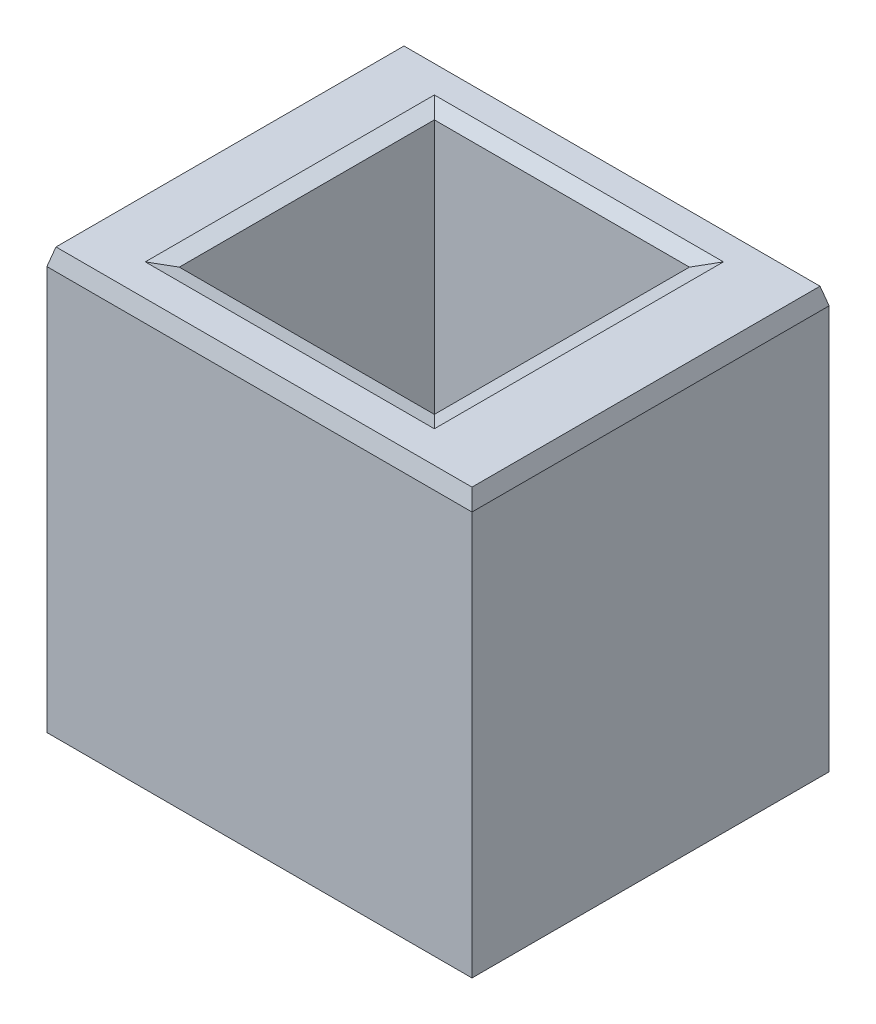
from build123d import *
from OCP.BRepFilletAPI import BRepFilletAPI_MakeChamfer

# Parameters (mm, degrees)
SKETCH1_W           = 127
SKETCH1_H           = 106.690831556
BOSS_EXTRUDE1_DEPTH = 127
SKETCH3_W           = 76.2
SKETCH3_H           = 76.2
CUT_EXTRUDE1_DEPTH  = 165.203782008
CHAMFER1_SIZE       = 5.08
CHAMFER1_SIZE2      = 1.361181898


with BuildPart() as part:
    # Sketch1 → Boss-Extrude1 (new body)
    with BuildSketch(Plane(origin=(0, 0, 0), x_dir=(1, 0, 0), z_dir=(0, 1, 0))):
        with Locations((5.280383795, -24.777185501)):
            Rectangle(SKETCH1_W, SKETCH1_H)
    extrude(amount=BOSS_EXTRUDE1_DEPTH)

    # Sketch3 → Cut-Extrude1 (cut, through all)
    with BuildSketch(Plane(origin=(0, 0, 0), x_dir=(1, 0, 0), z_dir=(0, 1, 0))):
        with Locations((3.524009173, -24.106880488)):
            Rectangle(SKETCH3_W, SKETCH3_H)
    extrude(amount=CUT_EXTRUDE1_DEPTH, mode=Mode.SUBTRACT)

    # Chamfer1: one chamfer whose edges measure the first distance from different faces: ONE call of the kernel's chamfer builder (chamfer() names one face for all edges)
    chamfer1_edges_1 = [part.edges().sort_by_distance(p)[0] for p in [
        (68.780383795, 127, 24.777185501),
    ]]
    chamfer1_side_1 = [part.faces().sort_by_distance(p)[0] for p in [
        (68.780383795, 63.5, 24.777185501),
    ]]
    chamfer1_edges_2 = [part.edges().sort_by_distance(p)[0] for p in [
        (5.280383795, 127, -28.568230277),
    ]]
    chamfer1_side_2 = [part.faces().sort_by_distance(p)[0] for p in [
        (5.280383795, 63.5, -28.568230277),
    ]]
    chamfer1_edges_3 = [part.edges().sort_by_distance(p)[0] for p in [
        (41.624009173, 0, 24.106880488),
    ]]
    chamfer1_side_3 = [part.faces().sort_by_distance(p)[0] for p in [
        (41.624009173, 63.5, 24.106880488),
    ]]
    chamfer1_edges_4 = [part.edges().sort_by_distance(p)[0] for p in [
        (3.524009173, 0, -13.993119512),
    ]]
    chamfer1_side_4 = [part.faces().sort_by_distance(p)[0] for p in [
        (3.524009173, 63.5, -13.993119512),
    ]]
    chamfer1_edges_5 = [part.edges().sort_by_distance(p)[0] for p in [
        (-34.575990827, 0, 24.106880488),
    ]]
    chamfer1_side_5 = [part.faces().sort_by_distance(p)[0] for p in [
        (-34.575990827, 63.5, 24.106880488),
    ]]
    chamfer1_edges_6 = [part.edges().sort_by_distance(p)[0] for p in [
        (3.524009173, 0, 62.206880488),
    ]]
    chamfer1_side_6 = [part.faces().sort_by_distance(p)[0] for p in [
        (3.524009173, 63.5, 62.206880488),
    ]]
    chamfer1_edges_7 = [part.edges().sort_by_distance(p)[0] for p in [
        (41.624009173, 127, 24.106880488),
        (3.524009173, 127, -13.993119512),
        (-34.575990827, 127, 24.106880488),
        (3.524009173, 127, 62.206880488),
    ]]
    chamfer1_side_7 = [part.faces().sort_by_distance(p)[0] for p in [
        (5.280383795, 127, -26.909558111),
    ]]
    chamfer1_edges_8 = [part.edges().sort_by_distance(p)[0] for p in [
        (-58.219616205, 127, 24.777185501),
    ]]
    chamfer1_side_8 = [part.faces().sort_by_distance(p)[0] for p in [
        (-58.219616205, 63.5, 24.777185501),
    ]]
    chamfer1_edges_9 = [part.edges().sort_by_distance(p)[0] for p in [
        (5.280383795, 0, -28.568230277),
        (68.780383795, 0, 24.777185501),
        (5.280383795, 0, 78.122601279),
        (-58.219616205, 0, 24.777185501),
    ]]
    chamfer1_side_9 = [part.faces().sort_by_distance(p)[0] for p in [
        (5.280383795, 0, -26.909558111),
    ]]
    chamfer1_edges_10 = [part.edges().sort_by_distance(p)[0] for p in [
        (5.280383795, 127, 78.122601279),
    ]]
    chamfer1_side_10 = [part.faces().sort_by_distance(p)[0] for p in [
        (5.280383795, 63.5, 78.122601279),
    ]]
    chamfer1 = BRepFilletAPI_MakeChamfer(part.part.solid().wrapped)
    for e in chamfer1_edges_1:
        chamfer1.Add(CHAMFER1_SIZE, CHAMFER1_SIZE2, e.wrapped, chamfer1_side_1[0].wrapped)  # the first distance lies on this face
    for e in chamfer1_edges_2:
        chamfer1.Add(CHAMFER1_SIZE, CHAMFER1_SIZE2, e.wrapped, chamfer1_side_2[0].wrapped)  # the first distance lies on this face
    for e in chamfer1_edges_3:
        chamfer1.Add(CHAMFER1_SIZE, CHAMFER1_SIZE2, e.wrapped, chamfer1_side_3[0].wrapped)  # the first distance lies on this face
    for e in chamfer1_edges_4:
        chamfer1.Add(CHAMFER1_SIZE, CHAMFER1_SIZE2, e.wrapped, chamfer1_side_4[0].wrapped)  # the first distance lies on this face
    for e in chamfer1_edges_5:
        chamfer1.Add(CHAMFER1_SIZE, CHAMFER1_SIZE2, e.wrapped, chamfer1_side_5[0].wrapped)  # the first distance lies on this face
    for e in chamfer1_edges_6:
        chamfer1.Add(CHAMFER1_SIZE, CHAMFER1_SIZE2, e.wrapped, chamfer1_side_6[0].wrapped)  # the first distance lies on this face
    for e in chamfer1_edges_7:
        chamfer1.Add(CHAMFER1_SIZE, CHAMFER1_SIZE2, e.wrapped, chamfer1_side_7[0].wrapped)  # the first distance lies on this face
    for e in chamfer1_edges_8:
        chamfer1.Add(CHAMFER1_SIZE, CHAMFER1_SIZE2, e.wrapped, chamfer1_side_8[0].wrapped)  # the first distance lies on this face
    for e in chamfer1_edges_9:
        chamfer1.Add(CHAMFER1_SIZE, CHAMFER1_SIZE2, e.wrapped, chamfer1_side_9[0].wrapped)  # the first distance lies on this face
    for e in chamfer1_edges_10:
        chamfer1.Add(CHAMFER1_SIZE, CHAMFER1_SIZE2, e.wrapped, chamfer1_side_10[0].wrapped)  # the first distance lies on this face
    add(Compound.cast(chamfer1.Shape()), mode=Mode.REPLACE)


solid = part.part
